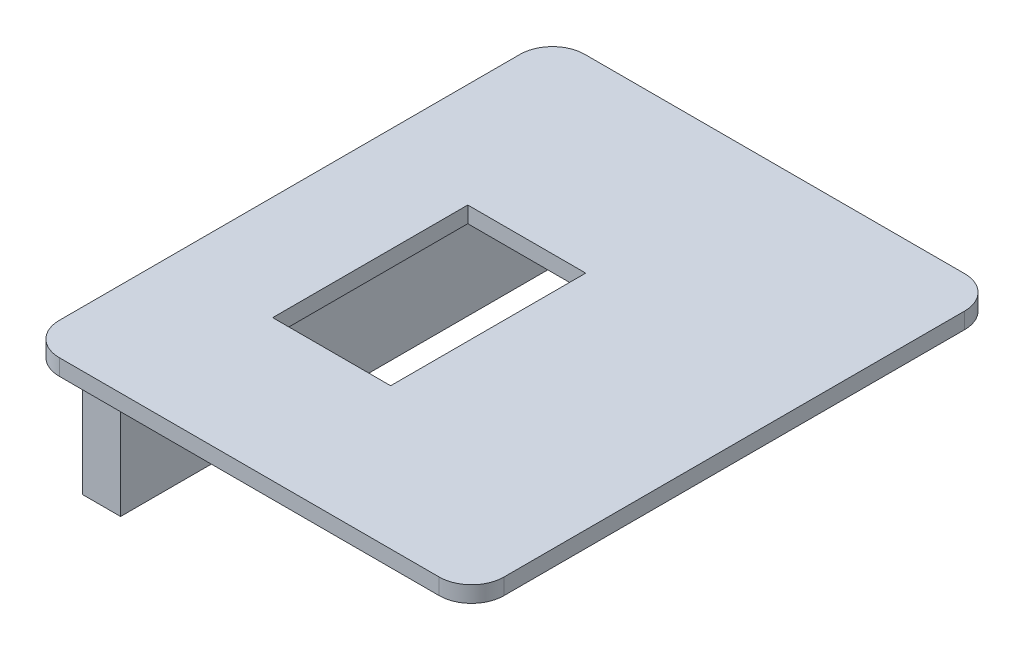
from build123d import *

# Parameters (mm, degrees)
SKETCH_1_W      = 14.591836735
SKETCH_1_H      = 24.132653061
EXTRUDE_1_DEPTH = 2
SKETCH_2_W      = 4.690013975
SKETCH_2_H      = 54.456273374
EXTRUDE_2_DEPTH = 16.5


with BuildPart() as part:
    # 草图1 → 凸台-拉伸1 (new body)
    with BuildSketch(Plane(origin=(0, 0, 0), x_dir=(1, 0, 0), z_dir=(0, 1, 0))):
        with BuildLine():
            Line((-23.5, -32.5), (23.5, -32.5))
            ThreePointArc((23.5, -32.5), (26.328427125, -31.328427125), (27.5, -28.5))
            Line((27.5, -28.5), (27.5, 28.5))
            ThreePointArc((27.5, 28.5), (26.328427125, 31.328427125), (23.5, 32.5))
            Line((23.5, 32.5), (-23.5, 32.5))
            ThreePointArc((-23.5, 32.5), (-26.328427125, 31.328427125), (-27.5, 28.5))
            Line((-27.5, 28.5), (-27.5, -28.5))
            ThreePointArc((-27.5, -28.5), (-26.328427125, -31.328427125), (-23.5, -32.5))
        make_face()
        with Locations((-7.295918368, -2.946428572)):
            Rectangle(SKETCH_1_W, SKETCH_1_H, mode=Mode.SUBTRACT)
    extrude(amount=EXTRUDE_1_DEPTH)

    # 草图2 → 凸台-拉伸2 (add)
    with BuildSketch(Plane.XZ):
        with Locations((-23.536921985, 0)):
            Rectangle(SKETCH_2_W, SKETCH_2_H)
    extrude(amount=EXTRUDE_2_DEPTH)


solid = part.part
